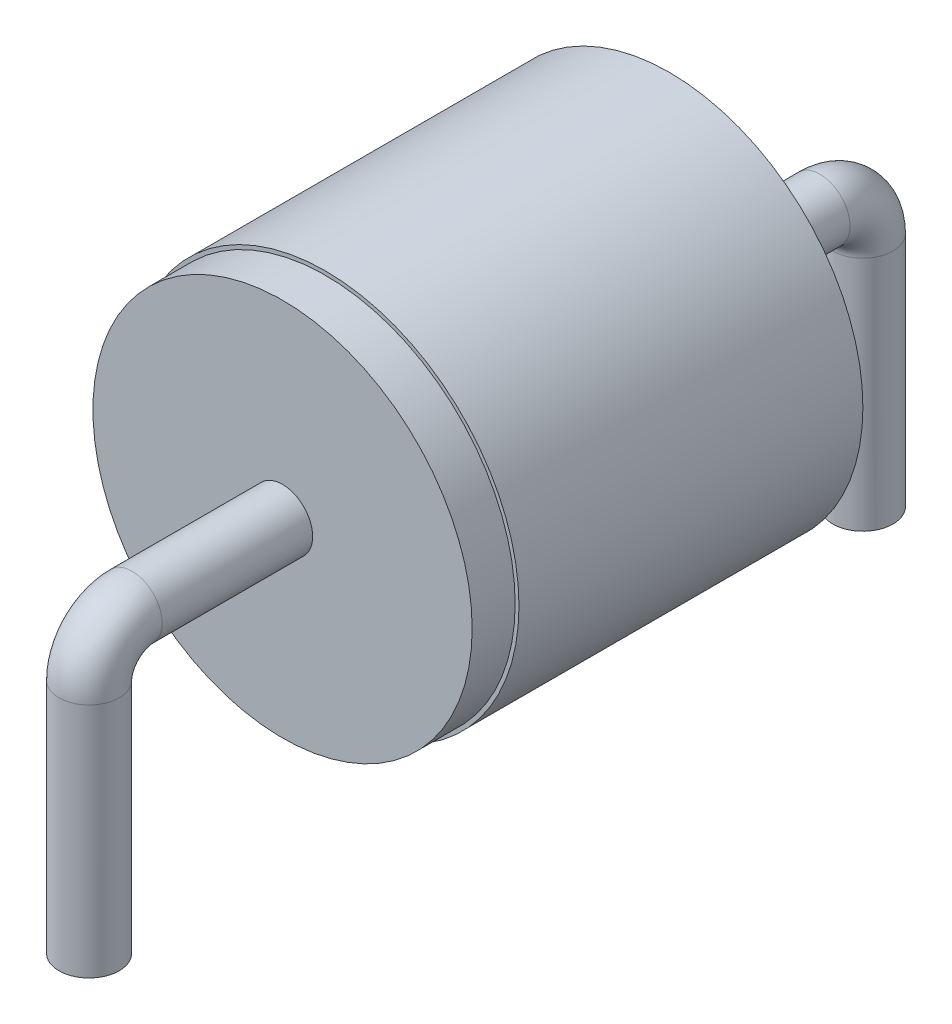
from build123d import *

# Parameters (mm, degrees)
SKETCH_1_R          = 4.5
EXTRUDE_1_DEPTH     = 4.5
SKETCH_2_R          = 5.333427414
SKETCH_2_R_2        = 4.410947686
CUT_EXTRUDE_1_DEPTH = 1
SKETCH_4_R          = 0.7


with BuildPart() as part:
    # Эскиз1 → Бобышка-Вытянуть1 (new, symmetric)
    with BuildSketch(Plane.XY):
        Circle(SKETCH_1_R)
    extrude(amount=EXTRUDE_1_DEPTH, both=True)

    # Эскиз2 → Вырез-Вытянуть1 (cut)
    with BuildSketch(Plane.XY.offset(4.5)):
        Circle(SKETCH_2_R)
        Circle(SKETCH_2_R_2, mode=Mode.SUBTRACT)
    extrude(amount=-CUT_EXTRUDE_1_DEPTH, mode=Mode.SUBTRACT)

    # По траектории1: sweep along a path in Эскиз3
    with BuildLine(Plane(origin=(0, 0, 0), x_dir=(0, 0, -1), z_dir=(1, 0, 0))) as sweep_1_path:
        Line((9, -6.5), (9, -1))
        ThreePointArc((9, -1), (8.707106781, -0.292893219), (8, 0))
        Line((8, 0), (-8, 0))
        ThreePointArc((-8, 0), (-8.707106781, -0.292893219), (-9, -1))
        Line((-9, -1), (-9, -6.5))
    # Эскиз4 → По траектории1 (sweep)
    with BuildSketch(Plane.XY):
        Circle(SKETCH_4_R)
    sweep(path=sweep_1_path.line)


solid = part.part
